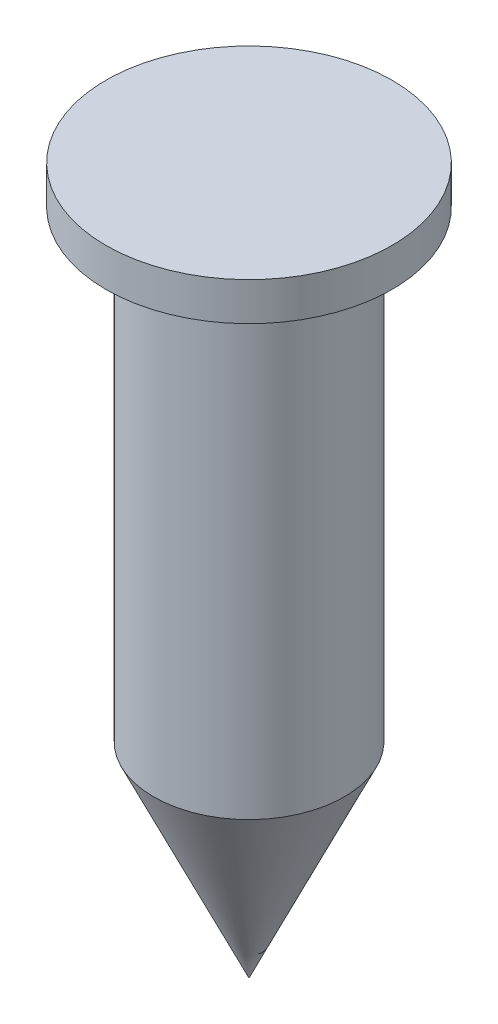
from build123d import *


with BuildPart() as part:
    # Sketch1 → Revolve1 (revolve)
    with BuildSketch(Plane.XY, mode=Mode.PRIVATE) as revolve1_sk:
        Polygon((0, 0), (7.5, 0), (7.5, -2), (5, -2), (5, -26.277465397), (0, -37), align=None)
    revolve(revolve1_sk.sketch.rotate(Axis((0, -42, 0), (0, 1, 0)), 90), axis=Axis((0, -42, 0), (0, 1, 0)))


solid = part.part
